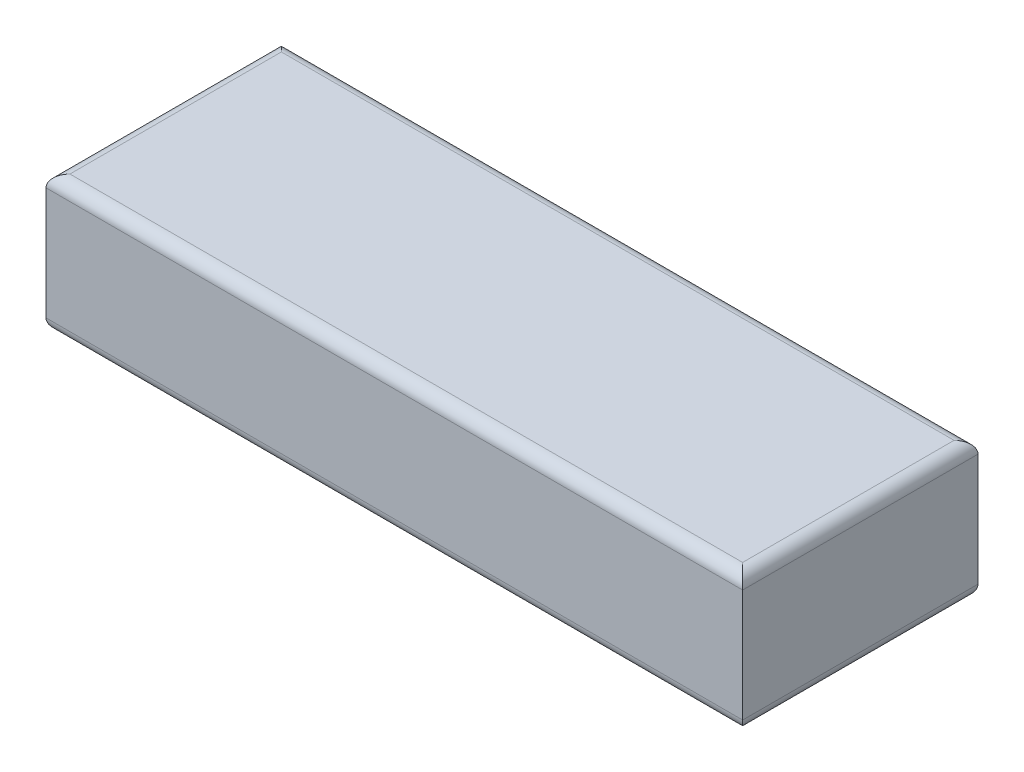
from build123d import *

# Parameters (mm, degrees)
SKETCH1_W           = 148
SKETCH1_H           = 50
BOSS_EXTRUDE1_DEPTH = 29
FILLET1_R           = 2.54


with BuildPart() as part:
    # Sketch1 → Boss-Extrude1 (new body)
    with BuildSketch(Plane(origin=(0, 0, 0), x_dir=(1, 0, 0), z_dir=(0, 1, 0))):
        with Locations((71.293650794, -27.414819758)):
            Rectangle(SKETCH1_W, SKETCH1_H)
    extrude(amount=BOSS_EXTRUDE1_DEPTH)

    # Fillet1
    fillet1_edges = [part.edges().sort_by_distance(p)[0] for p in [
        (145.293650794, 29, 27.414819758),
        (71.293650794, 29, 2.414819758),
        (-2.706349206, 29, 27.414819758),
        (71.293650794, 0, 2.414819758),
        (145.293650794, 0, 27.414819758),
        (71.293650794, 0, 52.414819758),
        (-2.706349206, 0, 27.414819758),
        (71.293650794, 29, 52.414819758),
    ]]
    fillet(fillet1_edges, radius=FILLET1_R)


solid = part.part
